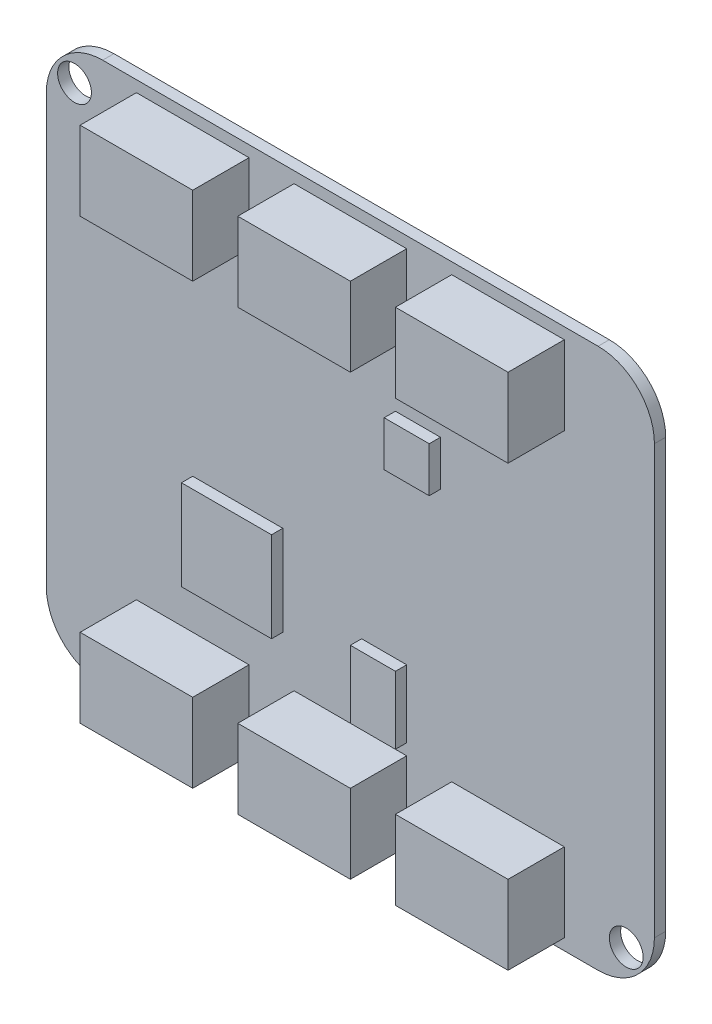
from build123d import *

# Parameters (mm, degrees)
SKETCH_1_W          = 54
SKETCH_1_H          = 48
EXTRUDE_1_DEPTH     = 1
SKETCH_2_R          = 1.5
CUT_EXTRUDE_1_DEPTH = 37.138621999
FILLET_1_R          = 5
SKETCH_3_W          = 10
SKETCH_3_H          = 7
EXTRUDE_2_DEPTH     = 5
SKETCH_4_W          = 8
SKETCH_4_H          = 8
SKETCH_4_W_2        = 4
SKETCH_4_H_2        = 6
SKETCH_4_H_3        = 4
EXTRUDE_3_DEPTH     = 1


with BuildPart() as part:
    # ｽｹｯﾁ1 → ﾎﾞｽ - 押し出し1 (new body)
    with BuildSketch(Plane.XY):
        Rectangle(SKETCH_1_W, SKETCH_1_H)
    extrude(amount=EXTRUDE_1_DEPTH)

    # ｽｹｯﾁ2 → ｶｯﾄ - 押し出し1 (cut, through all)
    with BuildSketch(Plane.XY.offset(1)):
        with Locations((-24.5, 21)):
            Circle(SKETCH_2_R)
        with Locations((24.5, -21)):
            Circle(SKETCH_2_R)
    extrude(amount=-CUT_EXTRUDE_1_DEPTH, mode=Mode.SUBTRACT)

    # ﾌｨﾚｯﾄ1
    fillet_1_edges = [part.edges().sort_by_distance(p)[0] for p in [
        (27, -24, 0.5),
        (-27, -24, 0.5),
        (-27, 24, 0.5),
        (27, 24, 0.5),
    ]]
    fillet(fillet_1_edges, radius=FILLET_1_R)

    # ｽｹｯﾁ3 → ﾎﾞｽ - 押し出し2 (add)
    with BuildSketch(Plane.XY.offset(1)):
        with Locations((-14, 19.5)):
            Rectangle(SKETCH_3_W, SKETCH_3_H)
        with Locations((0, 19.5)):
            Rectangle(SKETCH_3_W, SKETCH_3_H)
        with Locations((14, 19.5)):
            Rectangle(SKETCH_3_W, SKETCH_3_H)
        with Locations((-14, -19.5)):
            Rectangle(SKETCH_3_W, SKETCH_3_H)
        with Locations((0, -19.5)):
            Rectangle(SKETCH_3_W, SKETCH_3_H)
        with Locations((14, -19.5)):
            Rectangle(SKETCH_3_W, SKETCH_3_H)
    extrude(amount=EXTRUDE_2_DEPTH)

    # ｽｹｯﾁ4 → ﾎﾞｽ - 押し出し3 (add)
    with BuildSketch(Plane.XY.offset(1)):
        with Locations((-10, -8)):
            Rectangle(SKETCH_4_W, SKETCH_4_H)
        with Locations((3, -12)):
            Rectangle(SKETCH_4_W_2, SKETCH_4_H_2)
        with Locations((6, 8)):
            Rectangle(SKETCH_4_W_2, SKETCH_4_H_3)
    extrude(amount=EXTRUDE_3_DEPTH)


solid = part.part
